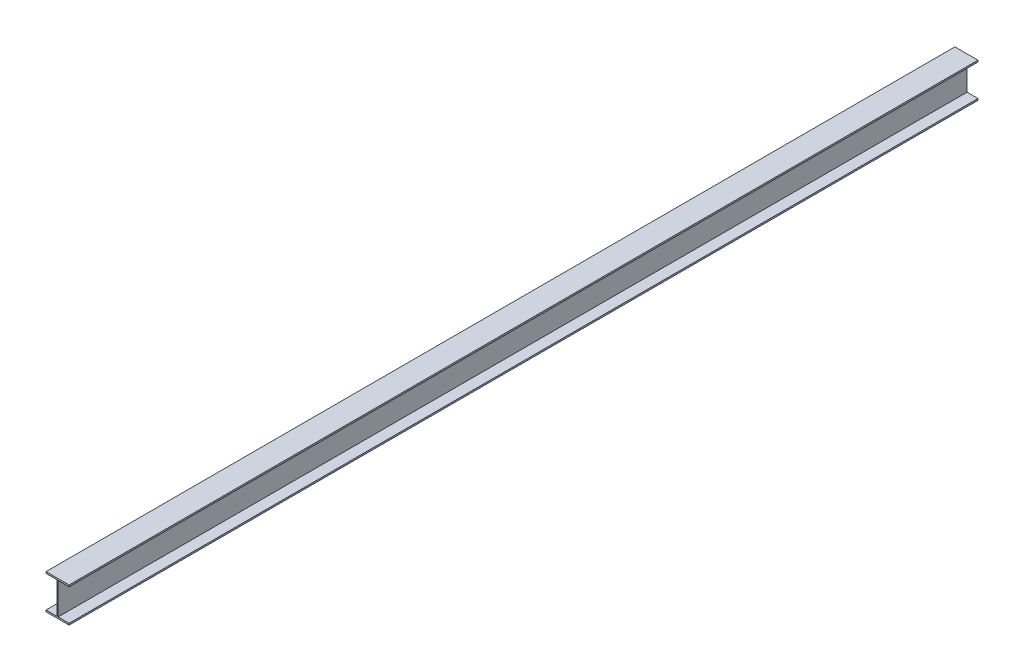
from build123d import *

# Parameters (mm, degrees)
BOSS_EXTRUDE1_DEPTH = 4000


with BuildPart() as part:
    # Sketch1 → Boss-Extrude1 (new body)
    with BuildSketch(Plane.XY):
        Polygon((0, -0.000240533), (101.6, -0.000240533), (101.6, -7.112240533), (53.408035714, -7.112240533), (53.408035714, -146.050240533), (101.6, -146.050240533), (101.6, -153.162240533), (0, -153.162240533), (0, -146.050240533), (47.566035714, -146.050240533), (47.566035714, -7.112240533), (0, -7.112240533), align=None)
    extrude(amount=BOSS_EXTRUDE1_DEPTH)


solid = part.part
